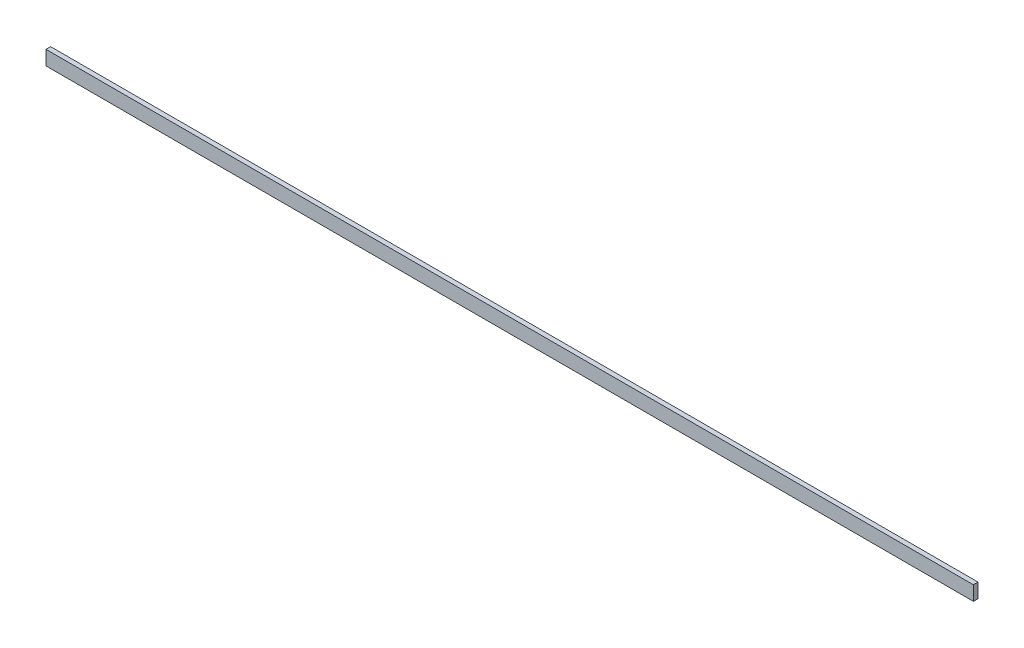
from build123d import *

# Parameters (mm, degrees)
ESQUISSE1_W        = 20000
ESQUISSE1_H        = 310
BOSS_EXTRU_1_DEPTH = 100


with BuildPart() as part:
    # Esquisse1 → Boss.-Extru.1 (new body)
    with BuildSketch(Plane.XY):
        with Locations((9989.504731317, -152.955689829)):
            Rectangle(ESQUISSE1_W, ESQUISSE1_H)
    extrude(amount=BOSS_EXTRU_1_DEPTH)


solid = part.part
